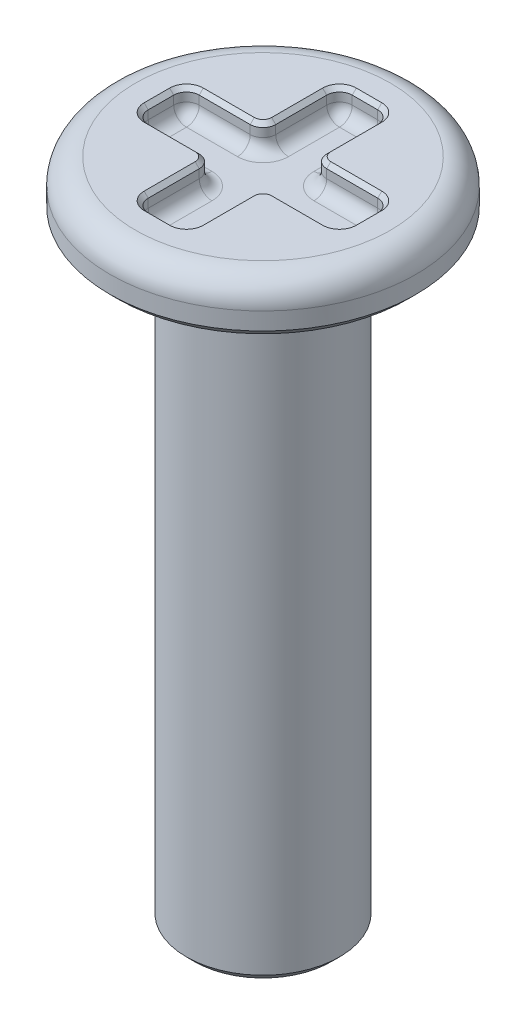
from build123d import *

# Parameters (mm, degrees)
CUT_EXTRUDE1_DEPTH = 0.79375
FILLET2_R          = 0.79375
FILLET3_R          = 0.396875
CHAMFER1_SIZE      = 0.254
CHAMFER2_SIZE      = 0.127


with BuildPart() as part:
    # Sketch1 → Revolve1 (revolve)
    with BuildSketch(Plane.XY, mode=Mode.PRIVATE) as revolve1_sk:
        Polygon((0, 0), (2.38125, 0), (2.38125, 19.05), (4.7625, 19.05), (4.7625, 20.6375), (0, 20.6375), align=None)
    revolve(revolve1_sk.sketch.rotate(Axis((0, 5.173549107, 0), (0, -1, 0)), 90), axis=Axis((0, 5.173549107, 0), (0, -1, 0)))

    # Sketch2 → Cut-Extrude1 (cut)
    with BuildSketch(Plane(origin=(0, 20.6375, 0), x_dir=(1, 0, 0), z_dir=(0, 1, 0))):
        Polygon((-3.175, 0.79375), (-0.79375, 0.79375), (-0.79375, 3.175), (0.79375, 3.175), (0.79375, 0.79375), (3.175, 0.79375), (3.175, -0.79375), (0.79375, -0.79375), (0.79375, -3.175), (-0.79375, -3.175), (-0.79375, -0.79375), (-3.175, -0.79375), align=None)
    extrude(amount=-CUT_EXTRUDE1_DEPTH, mode=Mode.SUBTRACT)

    # Fillet2
    fillet2_edges = [part.edges().sort_by_distance(p)[0] for p in [
        (0, 20.6375, -4.7625),
        (0, 19.05, -2.38125),
    ]]
    fillet(fillet2_edges, radius=FILLET2_R)

    # Fillet3
    fillet3_edges = [part.edges().sort_by_distance(p)[0] for p in [
        (-3.175, 20.240625, -0.79375),
        (-0.79375, 20.240625, -0.79375),
        (-0.79375, 20.240625, -3.175),
        (0.79375, 20.240625, -3.175),
        (0.79375, 20.240625, -0.79375),
        (3.175, 20.240625, -0.79375),
        (3.175, 20.240625, 0.79375),
        (0.79375, 20.240625, 0.79375),
        (0.79375, 20.240625, 3.175),
        (-0.79375, 20.240625, 3.175),
        (-0.79375, 20.240625, 0.79375),
        (-3.175, 20.240625, 0.79375),
        (-1.984375, 19.84375, -0.79375),
        (-0.79375, 19.84375, -1.984375),
        (0, 19.84375, -3.175),
        (0.79375, 19.84375, -1.984375),
        (1.984375, 19.84375, -0.79375),
        (3.175, 19.84375, 0),
        (1.984375, 19.84375, 0.79375),
        (0.79375, 19.84375, 1.984375),
        (0, 19.84375, 3.175),
        (-0.79375, 19.84375, 1.984375),
        (-1.984375, 19.84375, 0.79375),
        (-3.175, 19.84375, 0),
    ]]
    fillet(fillet3_edges, radius=FILLET3_R)

    # Chamfer1
    chamfer1_edges = [part.edges().sort_by_distance(p)[0] for p in [
        (0, 19.05, -4.7625),
        (0, 0, -2.38125),
    ]]
    chamfer(chamfer1_edges, length=CHAMFER1_SIZE)

    # Chamfer2
    chamfer2_edges = [part.edges().sort_by_distance(p)[0] for p in [
        (-1.984375, 20.6375, -0.79375),
        (-0.79375, 20.6375, -1.984375),
        (0, 20.6375, -3.175),
        (0.79375, 20.6375, -1.984375),
        (1.984375, 20.6375, -0.79375),
        (3.175, 20.6375, 0),
        (1.984375, 20.6375, 0.79375),
        (0.79375, 20.6375, 1.984375),
        (0, 20.6375, 3.175),
        (-0.79375, 20.6375, 1.984375),
        (-1.984375, 20.6375, 0.79375),
        (-3.175, 20.6375, 0),
        (-0.909991996, 20.6375, -0.909991996),
        (0.909991996, 20.6375, -0.909991996),
        (0.909991996, 20.6375, 0.909991996),
        (-0.909991996, 20.6375, 0.909991996),
        (-3.058758004, 20.6375, -0.677508004),
        (-3.058758004, 20.6375, 0.677508004),
        (-0.677508004, 20.6375, 3.058758004),
        (0.677508004, 20.6375, 3.058758004),
        (3.058758004, 20.6375, 0.677508004),
        (3.058758004, 20.6375, -0.677508004),
        (-0.677508004, 20.6375, -3.058758004),
        (0.677508004, 20.6375, -3.058758004),
    ]]
    chamfer(chamfer2_edges, length=CHAMFER2_SIZE)


solid = part.part
